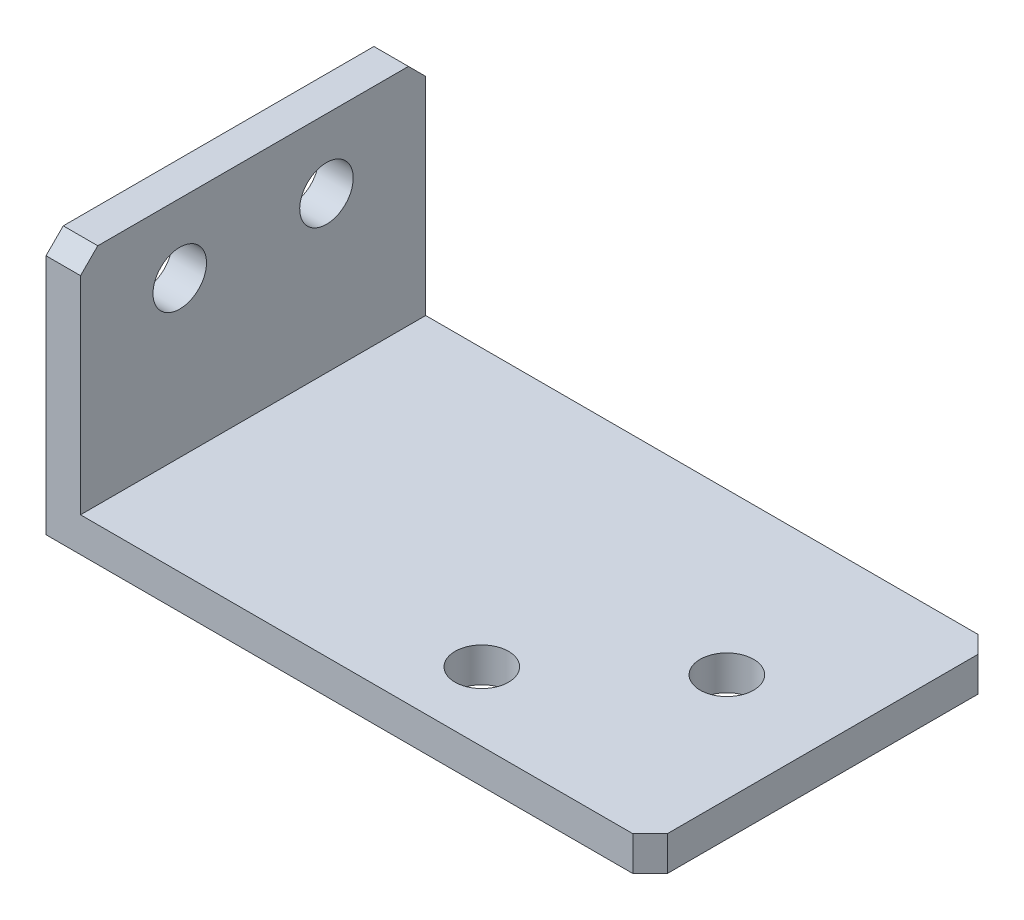
from build123d import *

# Parameters (mm, degrees)
BASE_DEPTH           = 20
SKETCH2_R            = 1.55
CARRIAGESIDE_DEPTH   = 2
SKETCH5_R            = 1.55
CABLECHAINSIDE_DEPTH = 43.355637169
CHAMFER1_SIZE        = 1


with BuildPart() as part:
    # Sketch1 → Base (new body)
    with BuildSketch(Plane.XY):
        Polygon((0, 0), (35, 0), (35, 2), (2, 2), (2, 15), (0, 15), align=None)
    extrude(amount=BASE_DEPTH)

    # Sketch2 → CarriageSide (cut)
    with BuildSketch(Plane.ZY):
        with Locations(Location((14.25, 11, 0), (0, 0, 270))):
            Circle(SKETCH2_R)
        with Locations(Location((5.75, 11, 0), (0, 0, 270))):
            Circle(SKETCH2_R)
    extrude(amount=-CARRIAGESIDE_DEPTH, mode=Mode.SUBTRACT)

    # Sketch5 → CableChainSide (cut, through all)
    with BuildSketch(Plane(origin=(0, 2, 0), x_dir=(1, 0, 0), z_dir=(0, 1, 0))):
        with Locations(Location((21.25, -16, 0), (0, 0, 180))):
            Circle(SKETCH5_R)
        with Locations(Location((28.75, -9.3, 0), (0, 0, 180))):
            Circle(SKETCH5_R)
    extrude(amount=-CABLECHAINSIDE_DEPTH, mode=Mode.SUBTRACT)

    # Chamfer1
    chamfer1_edges = [part.edges().sort_by_distance(p)[0] for p in [
        (35, 1, 20),
        (1, 15, 20),
        (1, 15, 0),
        (35, 1, 0),
    ]]
    chamfer(chamfer1_edges, length=CHAMFER1_SIZE)


solid = part.part
